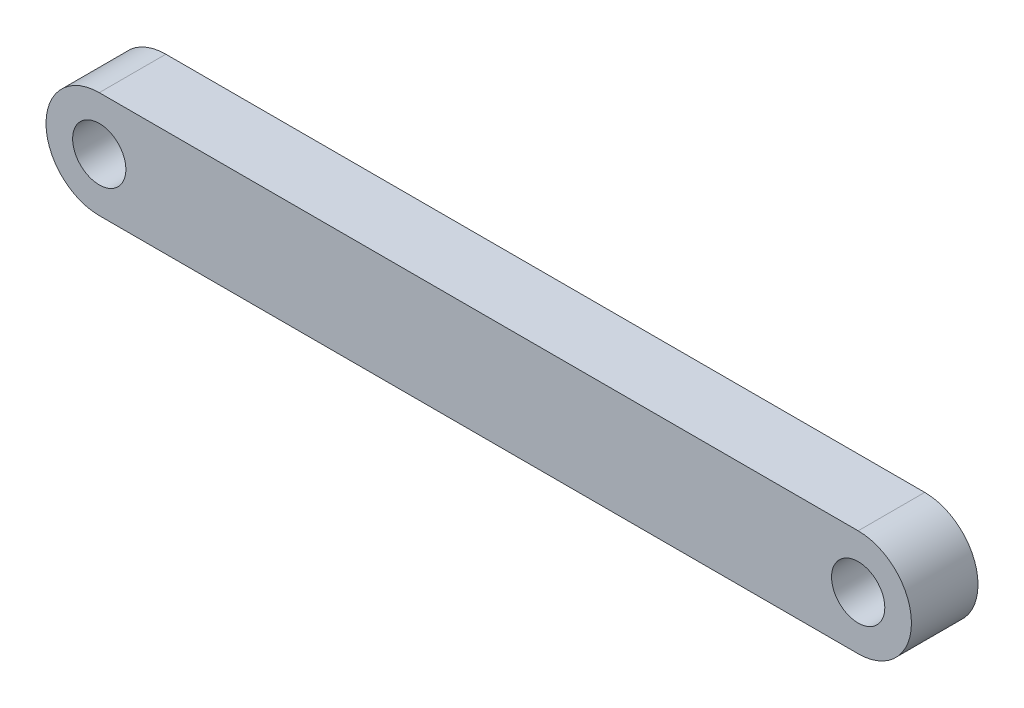
from build123d import *

# Parameters (mm, degrees)
BOSS_EXTRUDE1_DEPTH = 2.5
SKETCH2_R           = 2
CUT_EXTRUDE1_DEPTH  = 62.335144901


with BuildPart() as part:
    # Sketch1 → Boss-Extrude1 (new, symmetric)
    with BuildSketch(Plane.XY):
        with BuildLine():
            Line((0, 4), (57, 4))
            ThreePointArc((57, 4), (61, 0), (57, -4))
            Line((57, -4), (0, -4))
            ThreePointArc((0, -4), (-4, 0), (0, 4))
        make_face()
    extrude(amount=BOSS_EXTRUDE1_DEPTH, both=True)

    # Sketch2 → Cut-Extrude1 (cut, through all)
    with BuildSketch(Plane.XY.offset(2.5)):
        with Locations((57, 0)):
            Circle(SKETCH2_R)
        Circle(SKETCH2_R)
    extrude(amount=-CUT_EXTRUDE1_DEPTH, mode=Mode.SUBTRACT)


solid = part.part
